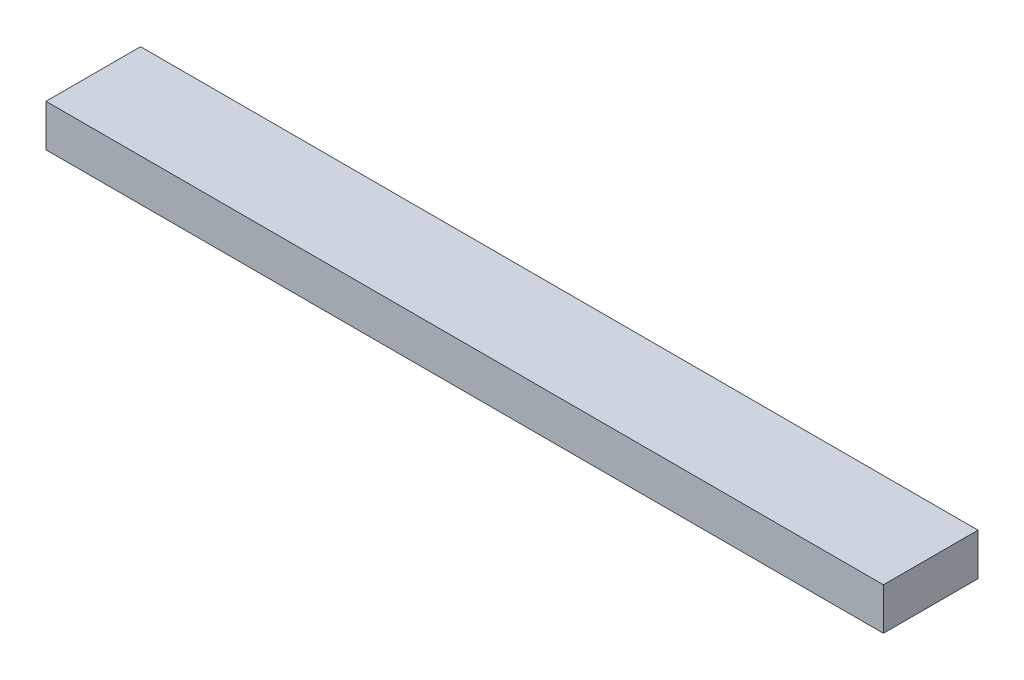
from build123d import *

# Parameters (mm, degrees)
SKETCH1_W           = 252.977532672
SKETCH1_H           = 12.7
BOSS_EXTRUDE1_DEPTH = 28.575


with BuildPart() as part:
    # Sketch1 → Boss-Extrude1 (new body)
    with BuildSketch(Plane.XY):
        with Locations((0, -304.8)):
            Rectangle(SKETCH1_W, SKETCH1_H)
    extrude(amount=BOSS_EXTRUDE1_DEPTH)


solid = part.part
